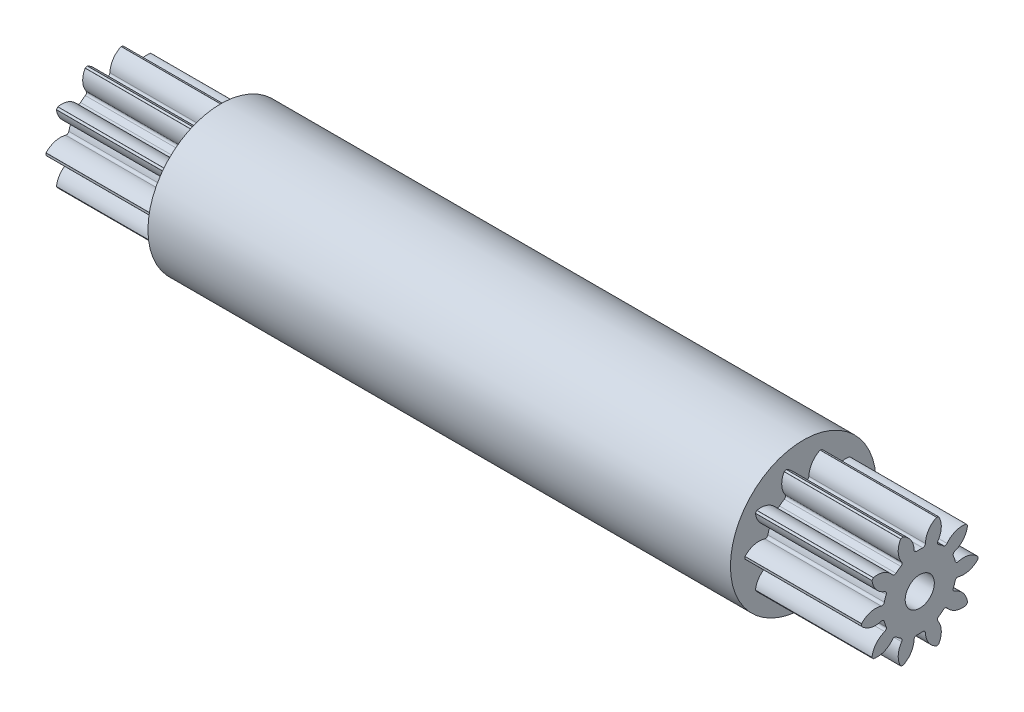
from build123d import *

# Parameters (mm, degrees)
BASPROSKE_W                = 12
BASPROSKE_H                = 6
TOOTHCUT_DEPTH             = 15.696938457
BREAKS_R                   = 0.02
ROOTFILLETS_R              = 0.251
TEETHCUTS_COUNT            = 10
TEETHCUTS_ANGLE            = 324
BREAKS_OF_TEETHCUTS_R      = 0.02
ROOTFILLETS_OF_TEETHCUTS_R = 0.251
BORSKE_R                   = 0.4
BORE_DEPTH                 = 50.0000508
SKETCH1_R                  = 7.5
BOSS_EXTRUDE1_DEPTH        = 30
SKETCH2_R                  = 1.5
CUT_EXTRUDE1_DEPTH         = 44.318587366


with BuildPart() as part:
    # BasProSke → Base-Revolve (revolve)
    with BuildSketch(Plane(origin=(0, 0, 0), x_dir=(1, 0, 0), z_dir=(0, 1, 0)), mode=Mode.PRIVATE) as base_revolve_sk:
        with Locations((6, 3)):
            Rectangle(BASPROSKE_W, BASPROSKE_H)
    revolve(base_revolve_sk.sketch.rotate(Axis((-10, 0, 0), (1, 0, 0)), 180), axis=Axis((-10, 0, 0), (1, 0, 0)))

    # TooCutSke → ToothCut (cut, through all)
    with BuildSketch(Plane(origin=(0, 0, 0), x_dir=(0, 0, -1), z_dir=(1, 0, 0))):
        with BuildLine():
            ThreePointArc((0.59278292, 3.701838653), (0, 3.749), (-0.59278292, 3.701838653))
            ThreePointArc((-0.59278292, 3.701838653), (-0.846593509, 4.924114224), (-1.775771316, 5.757784417))
            ThreePointArc((-1.775771316, 5.757784417), (0, 6.0254), (1.775771316, 5.757784417))
            ThreePointArc((1.775771316, 5.757784417), (0.846593509, 4.924114224), (0.59278292, 3.701838653))
        make_face()
    toothcut = extrude(amount=TOOTHCUT_DEPTH, mode=Mode.SUBTRACT)

    # Breaks
    breaks_edges = [part.edges().sort_by_distance(p)[0] for p in [
        (6, 5.741958524, -1.740664331),
        (6, 5.741958524, 1.740664331),
    ]]
    fillet(breaks_edges, radius=BREAKS_R)

    # RootFillets
    rootfillets_edges = [part.edges().sort_by_distance(p)[0] for p in [
        (6, 3.701838653, -0.59278292),
        (6, 3.701838653, 0.59278292),
    ]]
    fillet(rootfillets_edges, radius=ROOTFILLETS_R)

    # TeethCuts: ToothCut ×10 about axis
    teethcuts_axis = Axis((-10, 0, 0), (1, 0, 0))
    for i in range(1, TEETHCUTS_COUNT):
        add(toothcut.rotate(teethcuts_axis, i * TEETHCUTS_ANGLE / (TEETHCUTS_COUNT - 1)), mode=Mode.SUBTRACT)

    # Breaks of TeethCuts
    breaks_of_teethcuts_edges = [part.edges().sort_by_distance(p)[0] for p in [
        (6, 5.668478849, 1.966811514),
        (6, 3.622205204, 4.783265565),
        (6, 3.429832919, 4.92303221),
        (6, 0.11889261, 5.99882193),
        (6, -0.11889261, 5.99882193),
        (6, -3.429832919, 4.92303221),
        (6, -3.622205204, 4.783265565),
        (6, -5.668478849, 1.966811514),
        (6, -5.741958524, 1.740664331),
        (6, -5.741958524, -1.740664331),
        (6, -5.668478849, -1.966811514),
        (6, -3.622205204, -4.783265565),
        (6, -3.429832919, -4.92303221),
        (6, -0.11889261, -5.99882193),
        (6, 0.11889261, -5.99882193),
        (6, 3.429832919, -4.92303221),
        (6, 3.622205204, -4.783265565),
        (6, 5.668478849, -1.966811514),
    ]]
    fillet(breaks_of_teethcuts_edges, radius=BREAKS_OF_TEETHCUTS_R)

    # RootFillets of TeethCuts
    rootfillets_of_teethcuts_edges = [part.edges().sort_by_distance(p)[0] for p in [
        (6, 3.343279438, 1.69631471),
        (6, 2.646421322, 2.655457622),
        (6, 1.707701113, 3.337477777),
        (6, 0.580160996, 3.703837769),
        (6, -0.580160996, 3.703837769),
        (6, -1.707701113, 3.337477777),
        (6, -2.646421322, 2.655457622),
        (6, -3.343279438, 1.69631471),
        (6, -3.701838653, 0.59278292),
        (6, -3.701838653, -0.59278292),
        (6, -3.343279438, -1.69631471),
        (6, -2.646421322, -2.655457622),
        (6, -1.707701113, -3.337477777),
        (6, -0.580160996, -3.703837769),
        (6, 0.580160996, -3.703837769),
        (6, 1.707701113, -3.337477777),
        (6, 2.646421322, -2.655457622),
        (6, 3.343279438, -1.69631471),
    ]]
    fillet(rootfillets_of_teethcuts_edges, radius=ROOTFILLETS_OF_TEETHCUTS_R)

    # BorSke → Bore (cut, symmetric)
    with BuildSketch(Plane(origin=(0, 0, 0), x_dir=(0, 0, -1), z_dir=(1, 0, 0))):
        with Locations(Location((0, 0, 0), (0, 0, 180))):
            Circle(BORSKE_R)
    extrude(amount=BORE_DEPTH, both=True, mode=Mode.SUBTRACT)

    # Sketch1 → Boss-Extrude1 (add)
    with BuildSketch(Plane.ZY):
        Circle(SKETCH1_R)
    extrude(amount=BOSS_EXTRUDE1_DEPTH)

    # Sketch2 → Cut-Extrude1 (cut, through all)
    with BuildSketch(Plane.ZY.offset(30)):
        Circle(SKETCH2_R)
    extrude(amount=-CUT_EXTRUDE1_DEPTH, mode=Mode.SUBTRACT)

    # Mirror1: part across plane


with BuildPart() as part_1:
    add(part.part)
    add(part.part.mirror(Plane.ZY.offset(30)))


solid = part_1.part
